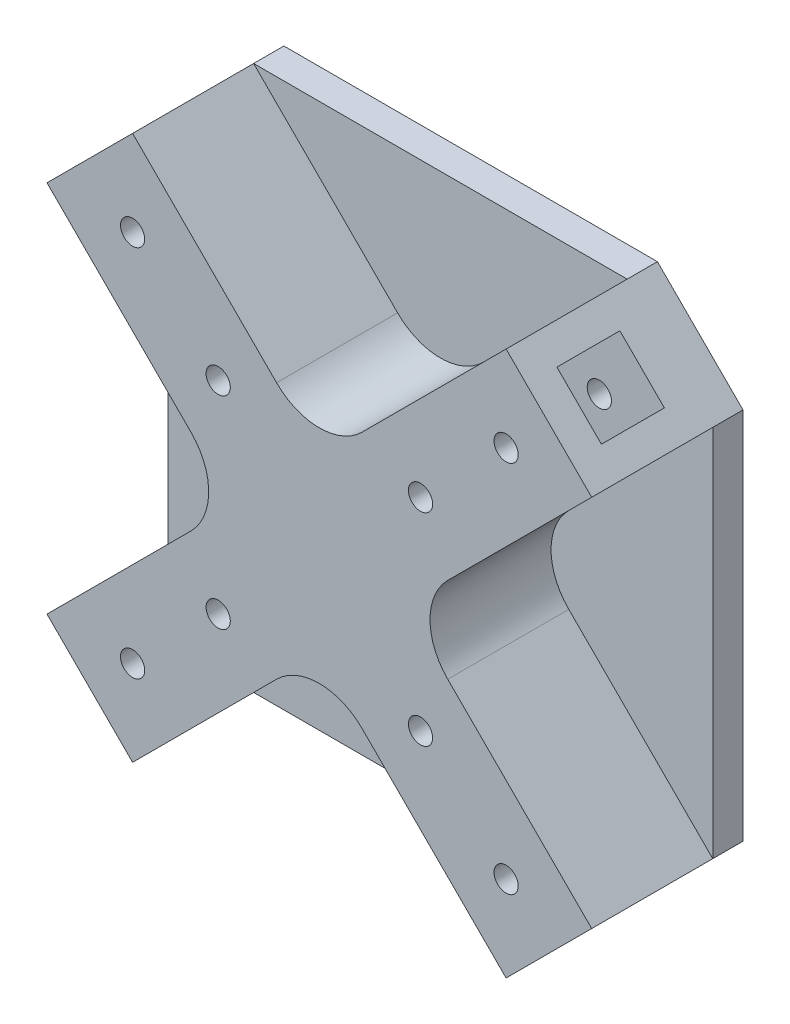
from build123d import *

# Parameters (mm, degrees)
BOSS_EXTRUDE1_DEPTH = 3.175
BOSS_EXTRUDE2_DEPTH = 12.7
SKETCH3_W           = 6.604
SKETCH3_H           = 6.604
CUT_EXTRUDE1_DEPTH  = 77.145517599
SKETCH4_R           = 1.27
CUT_EXTRUDE3_DEPTH  = 25.4


with BuildPart() as part:
    # Sketch1 → Boss-Extrude1 (new body)
    with BuildSketch(Plane.XY):
        Polygon((-28.575, 19.594743879), (-19.594743879, 28.575), (19.594743879, 28.575), (28.575, 19.594743879), (28.575, -19.594743879), (19.594743879, -28.575), (-19.594743879, -28.575), (-28.575, -19.594743879), align=None)
    extrude(amount=BOSS_EXTRUDE1_DEPTH)

    # Sketch2 → Boss-Extrude2 (add)
    with BuildSketch(Plane.XY.offset(3.175)):
        with BuildLine():
            Line((-28.575, 19.594743879), (-19.594743879, 28.575))
            Line((-19.594743879, 28.575), (-4.490128061, 13.470384182))
            ThreePointArc((-4.490128061, 13.470384182), (0, 11.610512242), (4.490128061, 13.470384182))
            Line((4.490128061, 13.470384182), (19.594743879, 28.575))
            Line((19.594743879, 28.575), (28.575, 19.594743879))
            Line((28.575, 19.594743879), (13.470384182, 4.490128061))
            ThreePointArc((13.470384182, 4.490128061), (11.610512242, 0), (13.470384182, -4.490128061))
            Line((13.470384182, -4.490128061), (28.575, -19.594743879))
            Line((28.575, -19.594743879), (19.594743879, -28.575))
            Line((19.594743879, -28.575), (4.490128061, -13.470384182))
            ThreePointArc((4.490128061, -13.470384182), (0, -11.610512242), (-4.490128061, -13.470384182))
            Line((-4.490128061, -13.470384182), (-19.594743879, -28.575))
            Line((-19.594743879, -28.575), (-28.575, -19.594743879))
            Line((-28.575, -19.594743879), (-13.470384182, -4.490128061))
            ThreePointArc((-13.470384182, -4.490128061), (-11.610512242, 0), (-13.470384182, 4.490128061))
            Line((-13.470384182, 4.490128061), (-28.575, 19.594743879))
        make_face()
    extrude(amount=BOSS_EXTRUDE2_DEPTH)

    # Sketch3 → Cut-Extrude1 (cut, symmetric)
    with BuildSketch(Plane(origin=(24.084871939, 24.084871939, 0), x_dir=(0, 0, -1), z_dir=(0.7071067811865472, 0.7071067811865479, 0))):
        with Locations((-9.398, 0)):
            Rectangle(SKETCH3_W, SKETCH3_H)
    cut_extrude1 = extrude(amount=CUT_EXTRUDE1_DEPTH, both=True, mode=Mode.SUBTRACT)

    # Mirror1: Cut-Extrude1 across plane
    add(cut_extrude1.mirror(Plane.ZX), mode=Mode.SUBTRACT)

    # Sketch4 → Cut-Extrude3 (cut)
    with BuildSketch(Plane(origin=(0, 0, 0), x_dir=(-1, 0, 0), z_dir=(0, 0, -1))):
        with Locations((-19.594743879, 19.594743879)):
            Circle(SKETCH4_R)
        with Locations((-10.614487758, 10.614487758)):
            Circle(SKETCH4_R)
        with Locations((10.614487758, 10.614487758)):
            Circle(SKETCH4_R)
        with Locations((19.594743879, 19.594743879)):
            Circle(SKETCH4_R)
        with Locations((19.594743879, -19.594743879)):
            Circle(SKETCH4_R)
        with Locations((10.614487758, -10.614487758)):
            Circle(SKETCH4_R)
        with Locations((-19.594743879, -19.594743879)):
            Circle(SKETCH4_R)
        with Locations((-10.614487758, -10.614487758)):
            Circle(SKETCH4_R)
    extrude(amount=-CUT_EXTRUDE3_DEPTH, mode=Mode.SUBTRACT)


solid = part.part
